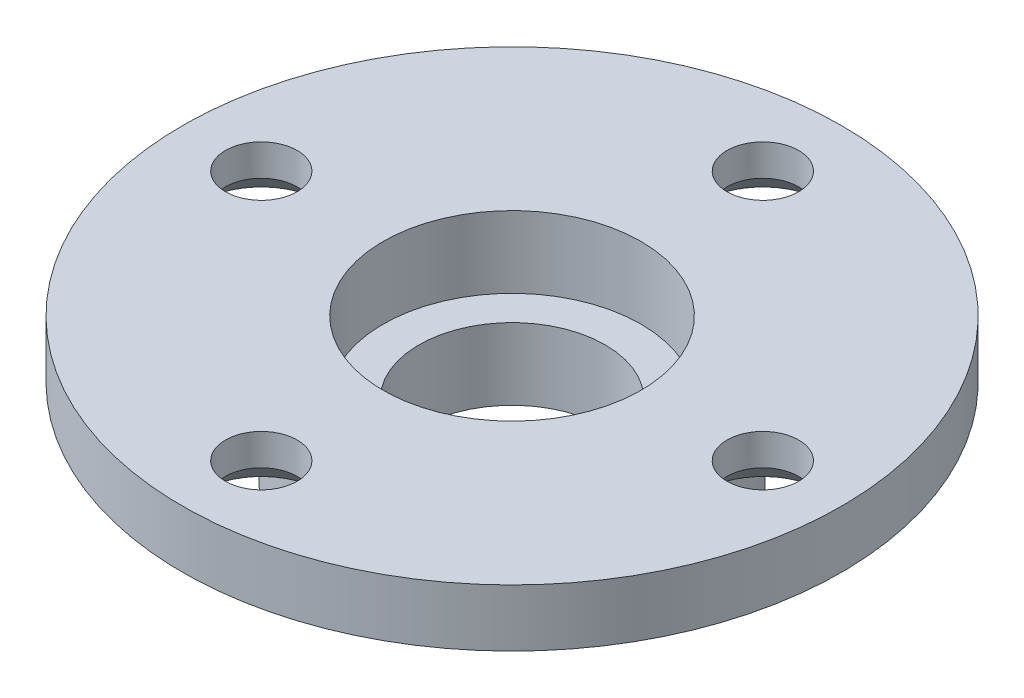
from build123d import *

# Parameters (mm, degrees)
FORO_5_0_5_1_D                        = 5
SMUSSO1_SIZE                          = 1.8
RIPETIZIONECIRCOLARE1_COUNT           = 4
SMUSSO1_OF_RIPETIZIONECIRCOLARE1_SIZE = 1.8


with BuildPart() as part:
    # Schizzo1 → Rivoluzione1 (revolve)
    with BuildSketch(Plane.XY, mode=Mode.PRIVATE) as rivoluzione1_sk:
        Polygon((6.5, 0), (12.5, 0), (12.5, 6), (23, 6), (23, 10), (9, 10), (9, 5), (6.5, 5), align=None)
    revolve(rivoluzione1_sk.sketch.rotate(Axis((0, 0, 0), (0, 1, 0)), 90), axis=Axis((0, 0, 0), (0, 1, 0)))

    # Foro Ø5.0 (5)-1 (through all)
    with Locations(Plane(origin=(0, 10, 0), x_dir=(1, 0, 0), z_dir=(0, 1, 0))):
        with Locations((17.5, 0)):
            foro_5_0_5_1 = Hole(FORO_5_0_5_1_D / 2)

    # Smusso1
    smusso1_edges = [part.edges().sort_by_distance(p)[0] for p in [
        (20, 6, 0),
    ]]
    chamfer(smusso1_edges, length=SMUSSO1_SIZE)

    # RipetizioneCircolare1: Foro Ø5.0 (5)-1 ×4 about axis
    ripetizionecircolare1_axis = Axis((0, 0, 0), (0, 1, 0))
    for i in range(1, RIPETIZIONECIRCOLARE1_COUNT):
        add(foro_5_0_5_1.rotate(ripetizionecircolare1_axis, i * 360 / RIPETIZIONECIRCOLARE1_COUNT), mode=Mode.SUBTRACT)

    # Smusso1 of RipetizioneCircolare1
    smusso1_of_ripetizionecircolare1_edges = [part.edges().sort_by_distance(p)[0] for p in [
        (0, 6, -20),
        (-20, 6, 0),
        (0, 6, 20),
    ]]
    chamfer(smusso1_of_ripetizionecircolare1_edges, length=SMUSSO1_OF_RIPETIZIONECIRCOLARE1_SIZE)


solid = part.part
